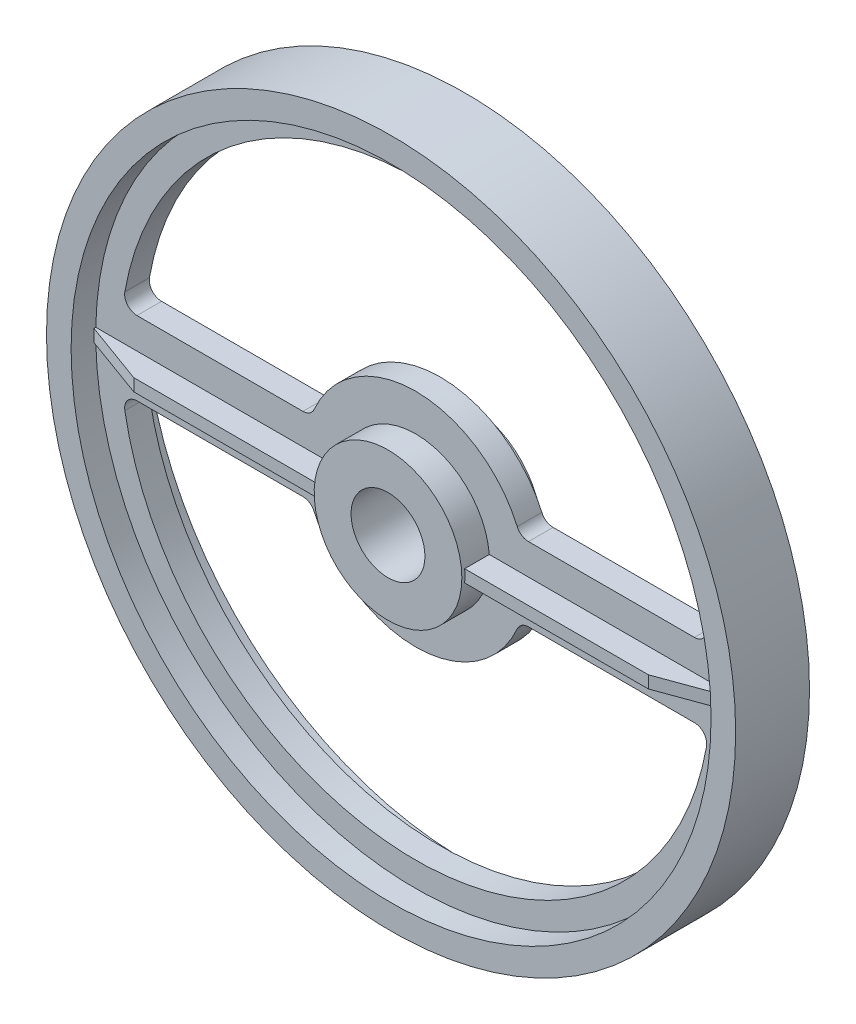
from build123d import *

# Parameters (mm, degrees)
SKETCH1_R                = 38.1
CENTERHUB_DEPTH          = 20.6375
RIB_DEPTH                = 3.175
LIGHTENING_HOLE_DEPTH    = 253.292660231
FILLET1_R                = 6.35
CIRPATTERN1_COUNT        = 2
FILLET1_OF_CIRPATTERN1_R = 6.35
THRU_HOLE_DEPTH          = 253.292660231
THRU_HOLE_DEPTH_BACK     = 253.292660231
SKETCH5_R                = 19.05


with BuildPart() as part:
    # Sketch1 → CenterHub (new, symmetric)
    with BuildSketch(Plane.XY):
        Circle(SKETCH1_R)
    extrude(amount=CENTERHUB_DEPTH, both=True)

    # Sketch2 → Rim and Web (revolve)
    with BuildSketch(Plane(origin=(0, 0, 0), x_dir=(0, 0, -1), z_dir=(1, 0, 0)), mode=Mode.PRIVATE) as rim_and_web_sk:
        Polygon((-6.35, 0), (6.35, 0), (6.35, 165.1), (19.05, 165.1), (19.05, 177.8), (-19.05, 177.8), (-19.05, 165.1), (-6.35, 165.1), align=None)
    revolve(rim_and_web_sk.sketch.rotate(Axis((0, 0, 0), (0, 0, -1)), 90), axis=Axis((0, 0, 0), (0, 0, -1)))

    # Sketch3 → Rib (add, symmetric)
    with BuildSketch(Plane(origin=(0, 0, 0), x_dir=(1, 0, 0), z_dir=(0, 1, 0))):
        Polygon((0, -19.05), (132.747036773, -19.05), (167.64, -6.35), (167.64, 6.35), (132.747036773, 19.05), (0, 19.05), align=None)
    rib = extrude(amount=RIB_DEPTH, both=True)

    # Sketch4 → Lightening hole (cut, symmetric)
    with BuildSketch(Plane.XY):
        with BuildLine():
            Line((-151.204687427, -19.05), (-53.881536726, -19.05))
            ThreePointArc((-53.881536726, -19.05), (0, -57.15), (53.881536726, -19.05))
            Line((53.881536726, -19.05), (151.204687427, -19.05))
            ThreePointArc((151.204687427, -19.05), (0, -152.4), (-151.204687427, -19.05))
        make_face()
    lightening_hole = extrude(amount=LIGHTENING_HOLE_DEPTH, both=True, mode=Mode.SUBTRACT)

    # Fillet1
    fillet1_edges = [part.edges().sort_by_distance(p)[0] for p in [
        (151.204687427, -19.05, 0),
        (-151.204687427, -19.05, 0),
        (-53.881536726, -19.05, 0),
        (53.881536726, -19.05, 0),
    ]]
    fillet(fillet1_edges, radius=FILLET1_R)

    # CirPattern1: Rib, Lightening hole ×2 about axis
    cirpattern1_axis = Axis((0, 0, 0), (0, 0, 1))
    add([rib.rotate(cirpattern1_axis, i * 360 / CIRPATTERN1_COUNT) for i in range(1, CIRPATTERN1_COUNT)])
    add([lightening_hole.rotate(cirpattern1_axis, i * 360 / CIRPATTERN1_COUNT) for i in range(1, CIRPATTERN1_COUNT)], mode=Mode.SUBTRACT)

    # Fillet1 of CirPattern1
    fillet1_of_cirpattern1_edges = [part.edges().sort_by_distance(p)[0] for p in [
        (-151.204687427, 19.05, 0),
        (151.204687427, 19.05, 0),
        (53.881536726, 19.05, 0),
        (-53.881536726, 19.05, 0),
    ]]
    fillet(fillet1_of_cirpattern1_edges, radius=FILLET1_OF_CIRPATTERN1_R)

    # Sketch5 → Thru hole (cut, two sides: drawn at the far end of the back side and taken through both)
    with BuildSketch(Plane.XY.offset(-THRU_HOLE_DEPTH_BACK)):
        Circle(SKETCH5_R)
    extrude(amount=THRU_HOLE_DEPTH + THRU_HOLE_DEPTH_BACK, mode=Mode.SUBTRACT)


solid = part.part
